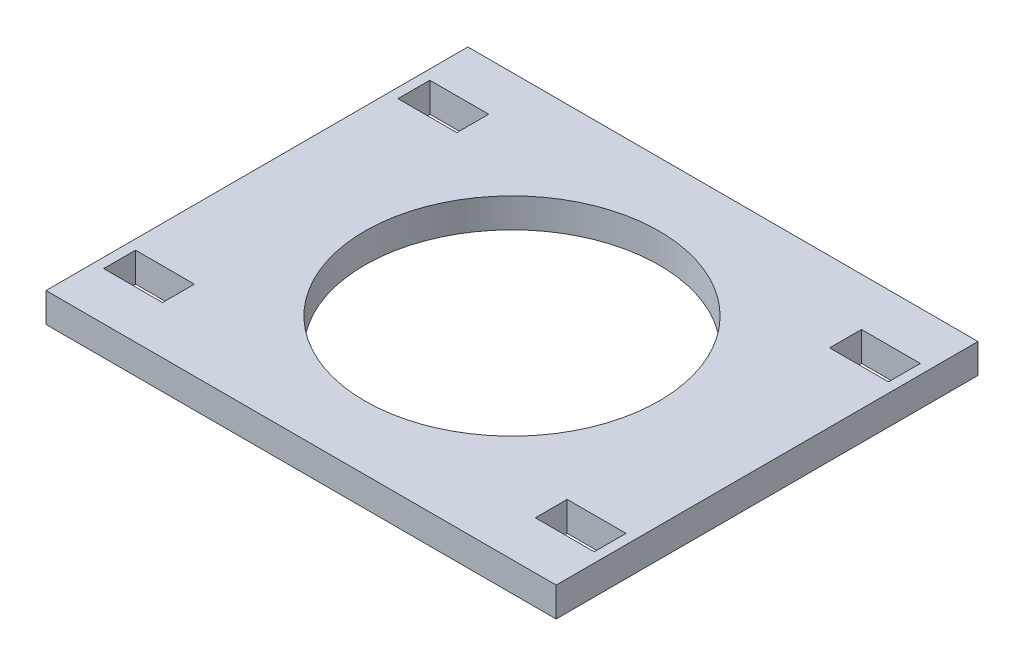
from build123d import *

# Parameters (mm, degrees)
SKETCH1_W                = 104
SKETCH1_H                = 86
SKETCH1_R                = 30
SKETCH1_W_2              = 12
SKETCH1_H_2              = 6.5
MOTOR_CRADLE_PLATE_DEPTH = 6


with BuildPart() as part:
    # Sketch1 → Motor_Cradle_Plate (new body)
    with BuildSketch(Plane(origin=(0, 0, 0), x_dir=(1, 0, 0), z_dir=(0, 1, 0))):
        Rectangle(SKETCH1_W, SKETCH1_H)
        with Locations(Location((0, 0, 0), (0, 0, 270))):
            Circle(SKETCH1_R, mode=Mode.SUBTRACT)
        with Locations((-44, -30)):
            Rectangle(SKETCH1_W_2, SKETCH1_H_2, mode=Mode.SUBTRACT)
        with Locations((-44, 30)):
            Rectangle(SKETCH1_W_2, SKETCH1_H_2, mode=Mode.SUBTRACT)
        with Locations((44, -30)):
            Rectangle(SKETCH1_W_2, SKETCH1_H_2, mode=Mode.SUBTRACT)
        with Locations((44, 30)):
            Rectangle(SKETCH1_W_2, SKETCH1_H_2, mode=Mode.SUBTRACT)
    extrude(amount=MOTOR_CRADLE_PLATE_DEPTH)


solid = part.part
